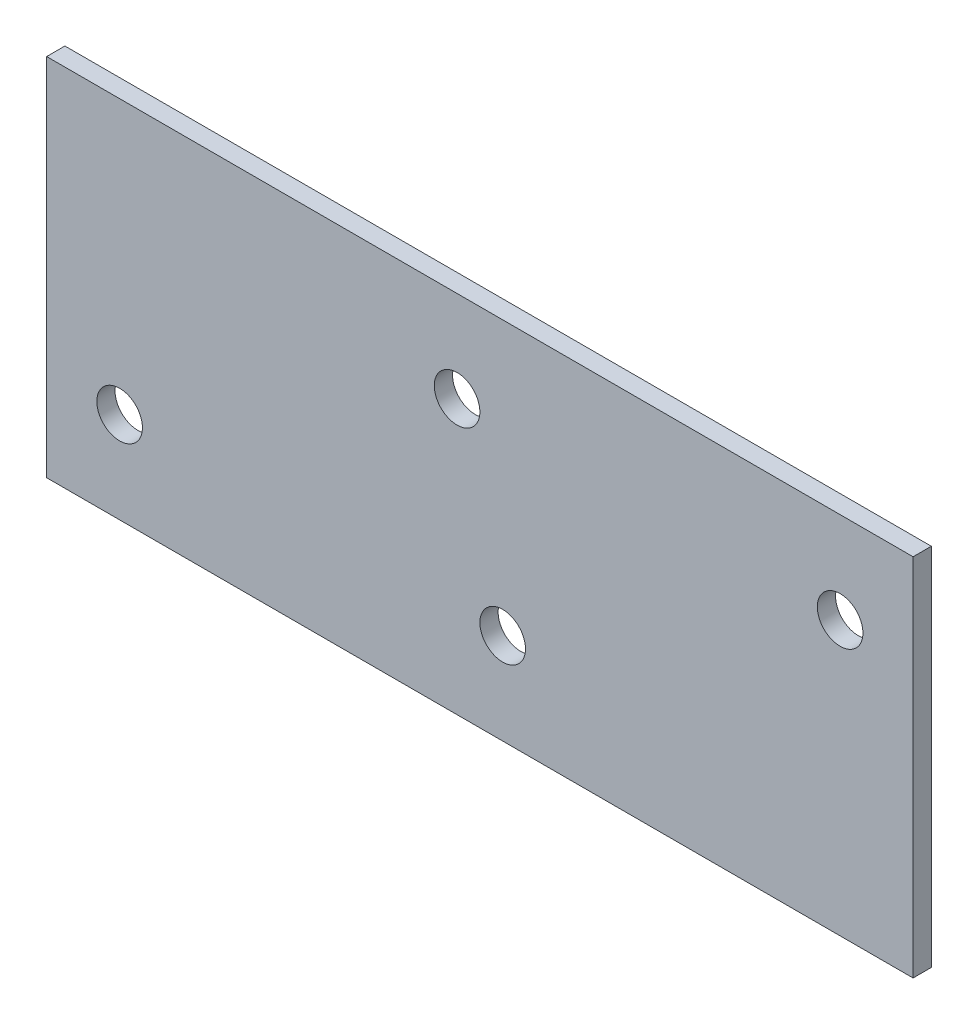
from build123d import *

# Parameters (mm, degrees)
SKETCH_1_W      = 95
SKETCH_1_H      = 40
SKETCH_1_R      = 2.5
EXTRUDE_1_DEPTH = 2


with BuildPart() as part:
    # 草图1 → 凸台-拉伸1 (new body)
    with BuildSketch(Plane.XY):
        with Locations((10, 0)):
            Rectangle(SKETCH_1_W, SKETCH_1_H)
        with Locations((7.5, 10)):
            Circle(SKETCH_1_R, mode=Mode.SUBTRACT)
        with Locations((12.5, -10)):
            Circle(SKETCH_1_R, mode=Mode.SUBTRACT)
        with Locations(Location((-29.5, -10, 0), (0, 0, 180))):
            Circle(SKETCH_1_R, mode=Mode.SUBTRACT)
        with Locations(Location((49.5, 10, 0), (0, 0, 180))):
            Circle(SKETCH_1_R, mode=Mode.SUBTRACT)
    extrude(amount=EXTRUDE_1_DEPTH)


solid = part.part
